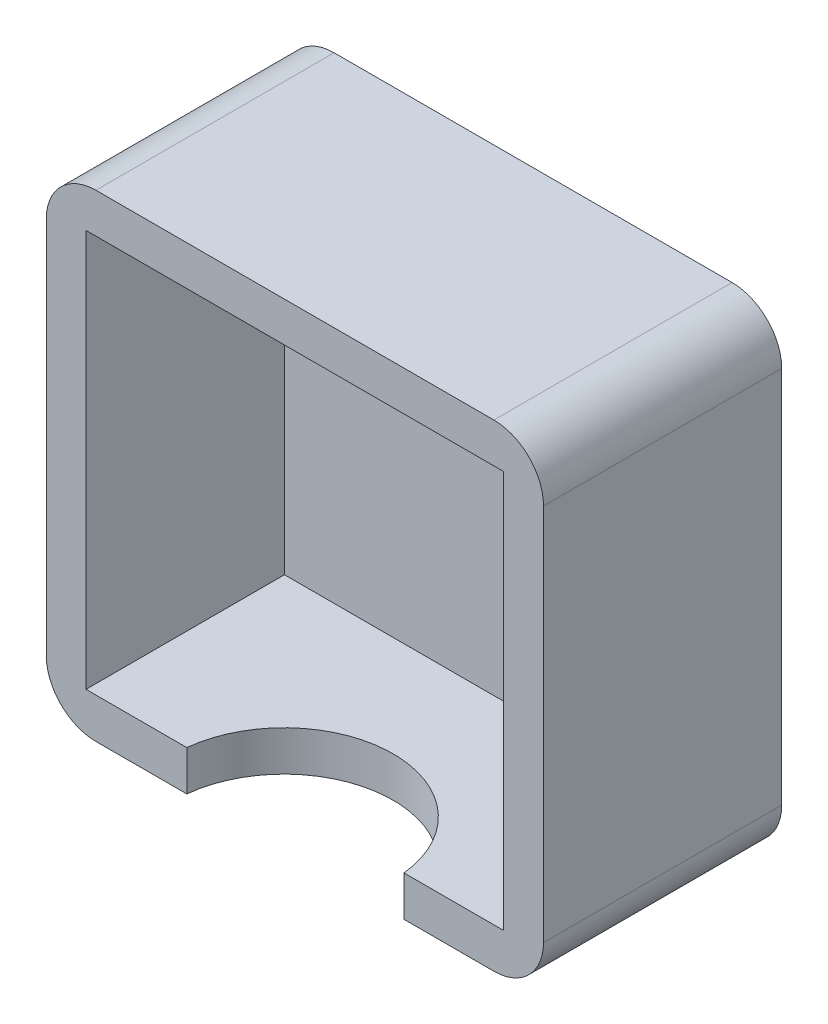
from build123d import *

# Parameters (mm, degrees)
ESBO_O1_W                = 50.1
ESBO_O1_H                = 48.1
ESBO_O1_W_2              = 42.05
ESBO_O1_H_2              = 40.05
RESSALTO_EXTRUS_O1_DEPTH = 20
ESBO_O3_W                = 50.1
ESBO_O3_H                = 48.1
RESSALTO_EXTRUS_O3_DEPTH = 4
ESBO_O4_R                = 11
CORTE_EXTRUS_O1_DEPTH    = 14
FILETE2_R                = 5


with BuildPart() as part:
    # Esboço1 → Ressalto-extrusão1 (new body)
    with BuildSketch(Plane.XY):
        with Locations((-2.099570717, -8.213533835)):
            Rectangle(ESBO_O1_W, ESBO_O1_H)
        with Locations((-2.124570717, -8.188533835)):
            Rectangle(ESBO_O1_W_2, ESBO_O1_H_2, mode=Mode.SUBTRACT)
    extrude(amount=RESSALTO_EXTRUS_O1_DEPTH)

    # Esboço3 → Ressalto-extrusão3 (add)
    with BuildSketch(Plane(origin=(0, 0, 0), x_dir=(-1, 0, 0), z_dir=(0, 0, -1))):
        with Locations((2.099570717, -8.213533835)):
            Rectangle(ESBO_O3_W, ESBO_O3_H)
    extrude(amount=RESSALTO_EXTRUS_O3_DEPTH)

    # Esboço4 → Corte-extrusão1 (cut)
    with BuildSketch(Plane.XZ.offset(32.263533835)):
        with Locations((-2.049570717, 21.15)):
            Circle(ESBO_O4_R)
    extrude(amount=-CORTE_EXTRUS_O1_DEPTH, mode=Mode.SUBTRACT)

    # Filete2
    filete2_edges = [part.edges().sort_by_distance(p)[0] for p in [
        (-27.149570717, 15.836466165, 8),
        (22.950429283, 15.836466165, 8),
        (22.950429283, -32.263533835, 8),
        (-27.149570717, -32.263533835, 8),
    ]]
    fillet(filete2_edges, radius=FILETE2_R)


solid = part.part
